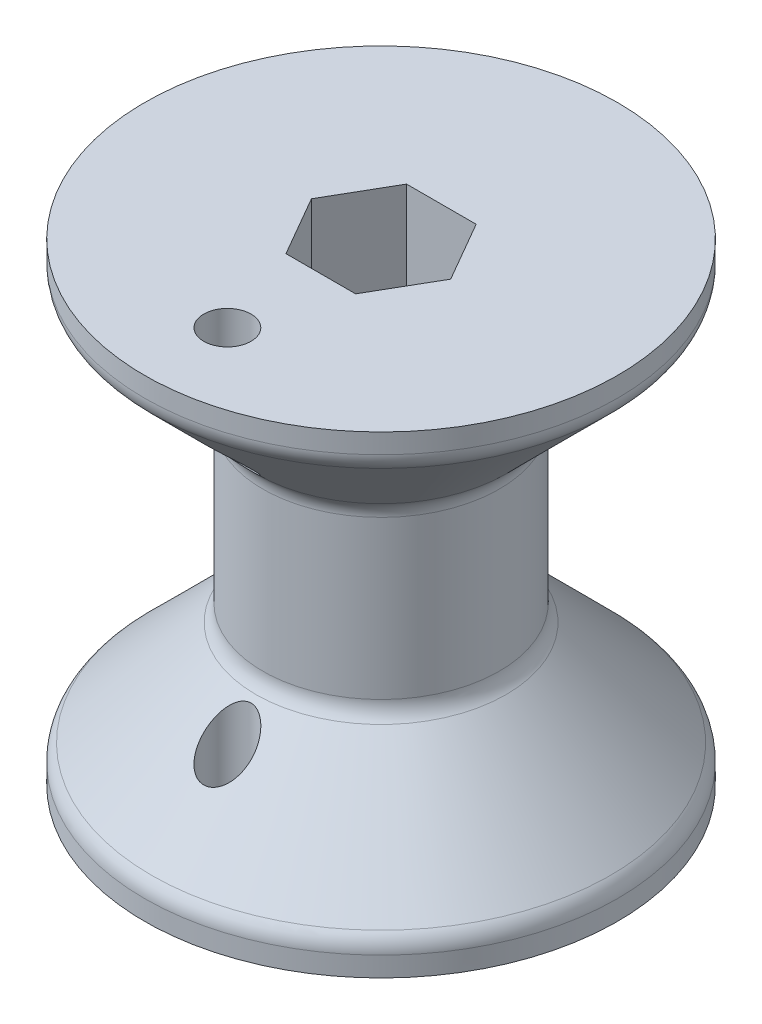
from build123d import *

# Parameters (mm, degrees)
SKETCH2_R          = 2.54
CUT_EXTRUDE1_DEPTH = 63.217039467
FILLET1_R          = 2.54


with BuildPart() as part:
    # Sketch1 → Revolve1 (revolve)
    with BuildSketch(Plane(origin=(0, 0, 0), x_dir=(0, 0, -1), z_dir=(1, 0, 0))):
        Polygon((0, 0), (0, 25.4), (25.4, 25.4), (25.4, 22.225), (12.7, 9.525), (12.7, 0), align=None)
    revolve1 = revolve(axis=Axis((0, 0, 0), (0, 1, 0)))

    # Mirror1: Revolve1 across plane
    add(revolve1.mirror(Plane(origin=(0, 0, -12.7), x_dir=(0, 0, 1), z_dir=(0, -1, 0))))

    # Sketch2 → Cut-Extrude1 (cut, through all)
    with BuildSketch(Plane(origin=(0, 25.4, 0), x_dir=(1, 0, 0), z_dir=(0, 1, 0))):
        with Locations(Location((0, -16.51, 0), (0, 0, 270))):
            Circle(SKETCH2_R)
        Polygon((-7.478995387, 0), (-3.739497694, -6.477), (3.739497694, -6.477), (7.478995387, 0), (3.739497694, 6.477), (-3.739497694, 6.477), align=None)
    extrude(amount=-CUT_EXTRUDE1_DEPTH, mode=Mode.SUBTRACT)

    # Fillet1
    fillet1_edges = [part.edges().sort_by_distance(p)[0] for p in [
        (0, -22.225, 25.4),
        (0, -9.525, 12.7),
        (0, 9.525, 12.7),
        (0, 22.225, 25.4),
    ]]
    fillet(fillet1_edges, radius=FILLET1_R)


solid = part.part
